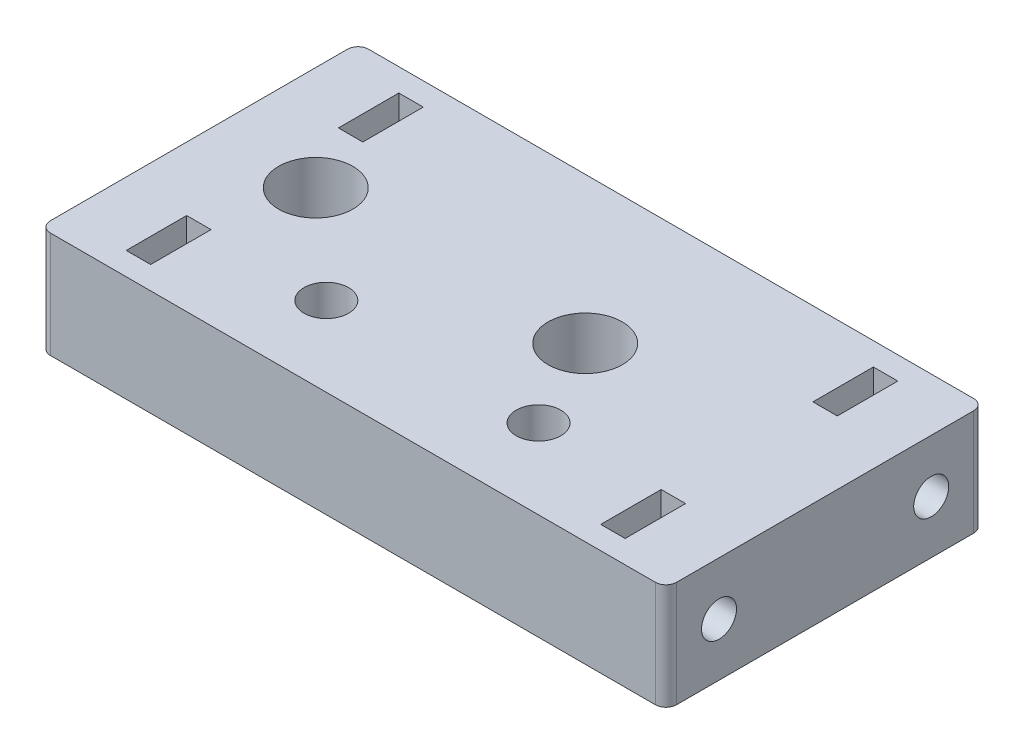
from build123d import *

# Parameters (mm, degrees)
SKETCH1_W           = 59.0272
SKETCH1_H           = 30
BOSS_EXTRUDE1_DEPTH = 10
SKETCH2_R           = 2.1
CUT_EXTRUDE1_DEPTH  = 35.58399319
SKETCH3_R           = 1.65
CUT_EXTRUDE2_DEPTH  = 12
CUT_EXTRUDE3_START  = -12
SKETCH4_R           = 1.65
CUT_EXTRUDE3_DEPTH  = 12
CUT_EXTRUDE4_DEPTH  = 2.3
CUT_EXTRUDE5_DEPTH  = 2.3
SKETCH7_R           = 3.5
CUT_EXTRUDE6_DEPTH  = 35.58399319
FILLET1_R           = 1


with BuildPart() as part:
    # Sketch1 → Boss-Extrude1 (new body)
    with BuildSketch(Plane(origin=(0, 0, 0), x_dir=(1, 0, 0), z_dir=(0, 1, 0))):
        Rectangle(SKETCH1_W, SKETCH1_H)
    extrude(amount=BOSS_EXTRUDE1_DEPTH)

    # Sketch2 → Cut-Extrude1 (cut, through all)
    with BuildSketch(Plane(origin=(0, 10, 0), x_dir=(1, 0, 0), z_dir=(0, 1, 0))):
        with Locations(Location((-10, -7.5, 0), (0, 0, 270))):
            Circle(SKETCH2_R)
        with Locations(Location((10, -7.5, 0), (0, 0, 270))):
            Circle(SKETCH2_R)
    extrude(amount=-CUT_EXTRUDE1_DEPTH, mode=Mode.SUBTRACT)

    # Sketch3 → Cut-Extrude2 (cut)
    with BuildSketch(Plane(origin=(29.5136, 0, 0), x_dir=(0, 0, -1), z_dir=(1, 0, 0))):
        with Locations((-10, 5)):
            Circle(SKETCH3_R)
        with Locations((10, 5)):
            Circle(SKETCH3_R)
    extrude(amount=-CUT_EXTRUDE2_DEPTH, mode=Mode.SUBTRACT)

    # Sketch4 → Cut-Extrude3 (cut)
    with BuildSketch(Plane.ZY.offset(29.5136).offset(CUT_EXTRUDE3_START)):
        with Locations(Location((-10, 5, 0), (0, 0, 180))):
            Circle(SKETCH4_R)
        with Locations(Location((10, 5, 0), (0, 0, 180))):
            Circle(SKETCH4_R)
    extrude(amount=CUT_EXTRUDE3_DEPTH, mode=Mode.SUBTRACT)

    # Sketch5 → Cut-Extrude4 (cut)
    with BuildSketch(Plane(origin=(23.5136, 0, 0), x_dir=(0, 0, -1), z_dir=(1, 0, 0))):
        Polygon((-12.85, 6.645448267), (-12.85, 10), (-7.15, 10), (-7.15, 6.645448267), (-7.15, 3.354551733), (-10, 1.709103466), (-12.85, 3.354551733), align=None)
        Polygon((7.15, 6.645448267), (7.15, 3.354551733), (10, 1.709103466), (12.85, 3.354551733), (12.85, 6.645448267), (12.85, 10), (7.15, 10), align=None)
    extrude(amount=-CUT_EXTRUDE4_DEPTH, mode=Mode.SUBTRACT)

    # Sketch6 → Cut-Extrude5 (cut)
    with BuildSketch(Plane.ZY.offset(23.5136)):
        Polygon((-12.85, 6.645448267), (-12.85, 10), (-7.15, 10), (-7.15, 6.645448267), (-7.15, 3.354551733), (-10, 1.709103466), (-12.85, 3.354551733), align=None)
        Polygon((7.15, 6.645448267), (7.15, 3.354551733), (10, 1.709103466), (12.85, 3.354551733), (12.85, 6.645448267), (12.85, 10), (7.15, 10), align=None)
    extrude(amount=-CUT_EXTRUDE5_DEPTH, mode=Mode.SUBTRACT)

    # Sketch7 → Cut-Extrude6 (cut, through all)
    with BuildSketch(Plane(origin=(0, 10, 0), x_dir=(1, 0, 0), z_dir=(0, 1, 0))):
        with Locations(Location((5.7, 1.2, 0), (0, 0, 270))):
            Circle(SKETCH7_R)
        with Locations(Location((-19.7, 1.2, 0), (0, 0, 270))):
            Circle(SKETCH7_R)
    extrude(amount=-CUT_EXTRUDE6_DEPTH, mode=Mode.SUBTRACT)

    # Fillet1
    fillet1_edges = [part.edges().sort_by_distance(p)[0] for p in [
        (29.5136, 5, 15),
        (-29.5136, 5, 15),
        (-29.5136, 5, -15),
        (29.5136, 5, -15),
    ]]
    fillet(fillet1_edges, radius=FILLET1_R)


solid = part.part
